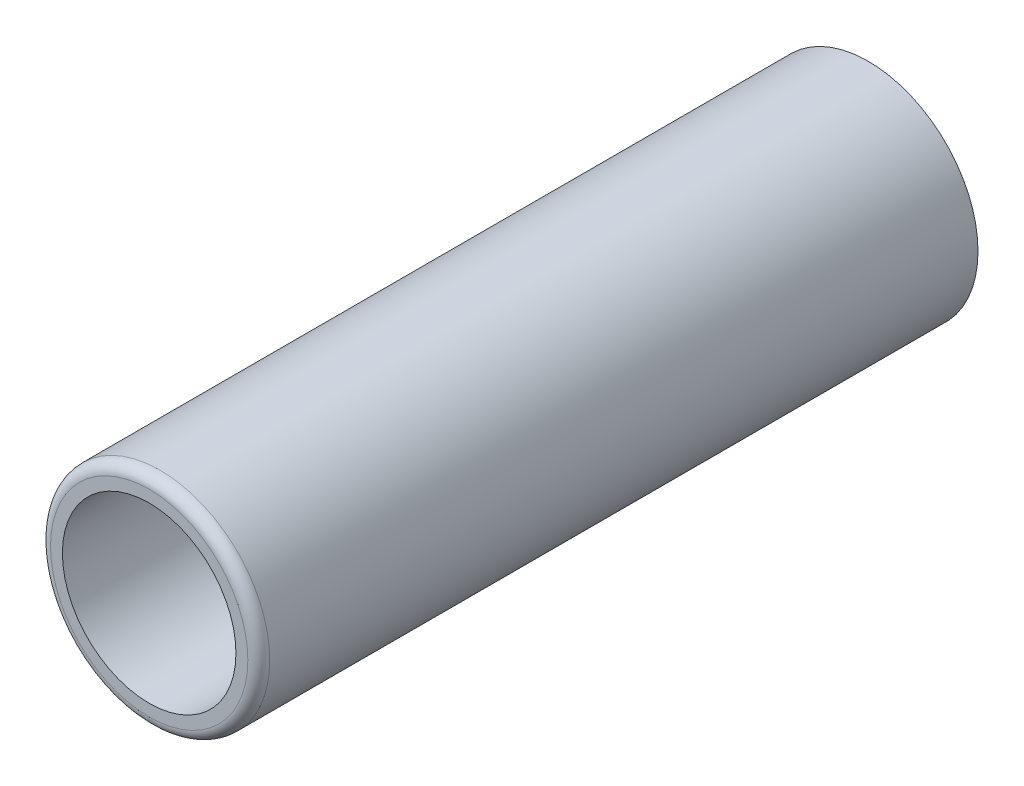
from build123d import *

# Parameters (mm, degrees)
EXTRUDE1_DEPTH  = 58.42
SKETCH2_R       = 7.62
EXTRUDE2_DEPTH  = 50
SKETCH3_R       = 6.0325
EXTRUDE12_DEPTH = 110.253593305
FILLET1_R       = 0.762


with BuildPart() as part:
    # Sketch1 → Extrude1 (new body)
    with BuildSketch(Plane.XY):
        with BuildLine():
            Line((-9.525, 8.699334611), (9.525, 8.699334611))
            Line((9.525, 8.699334611), (9.525, 0))
            ThreePointArc((9.525, 0), (0, -9.525), (-9.525, 0))
            Line((-9.525, 0), (-9.525, 8.699334611))
        make_face()
    extrude(amount=EXTRUDE1_DEPTH)


with BuildPart() as body_2:
    # Sketch2 → Extrude2 (new body)
    with BuildSketch(Plane.XY.offset(58.42)):
        Circle(SKETCH2_R)
    extrude(amount=EXTRUDE2_DEPTH)


with BuildPart() as extrude12_tool:
    # Sketch3 → Extrude12 (new, through all)
    with BuildSketch(Plane.XY.offset(108.42)):
        Circle(SKETCH3_R)
    extrude(amount=-EXTRUDE12_DEPTH)


with BuildPart() as part_1:
    add(part.part)

    # Extrude12: cut by extrude12_tool
    add(extrude12_tool.part, mode=Mode.SUBTRACT)


with BuildPart() as body_2_1:
    add(body_2.part)

    # Extrude12: cut by extrude12_tool
    add(extrude12_tool.part, mode=Mode.SUBTRACT)

    # Fillet1
    fillet1_edges = [body_2_1.edges().sort_by_distance(p)[0] for p in [
        (-7.62, 0, 108.42),
    ]]
    fillet(fillet1_edges, radius=FILLET1_R)


solid = body_2_1.part
